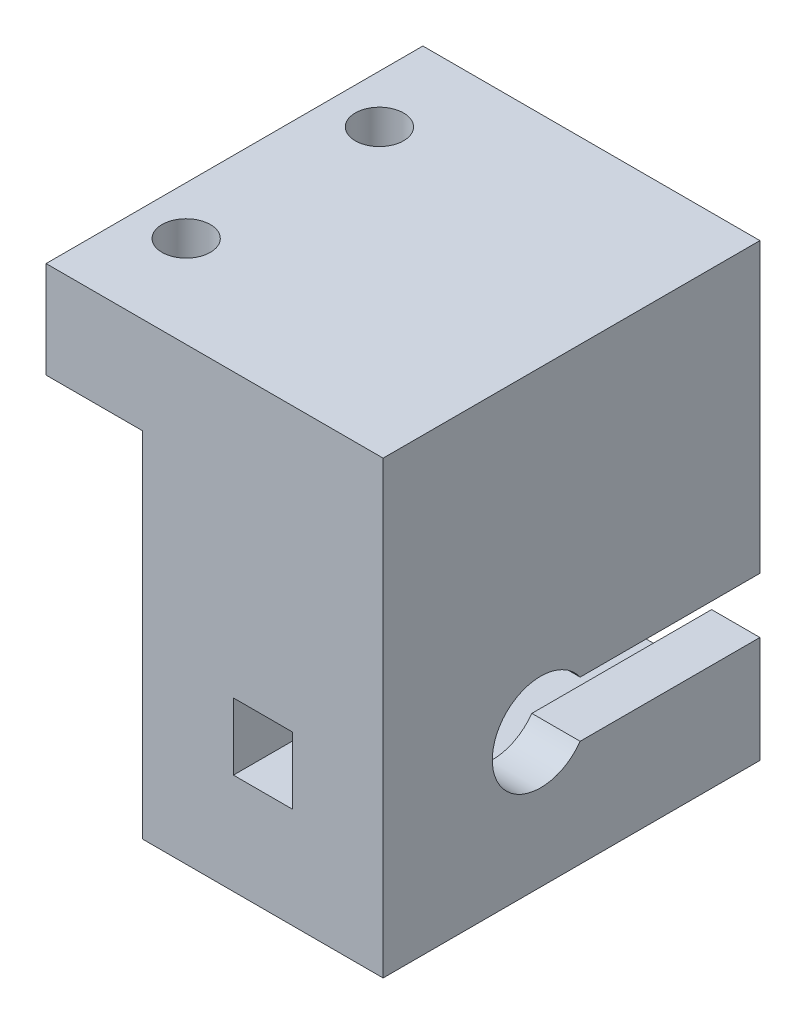
from build123d import *

# Parameters (mm, degrees)
SKETCH1_W           = 31.6
SKETCH1_H           = 35.300000012
SKETCH1_W_2         = 18.9
SKETCH1_H_2         = 22.600000012
BOSS_EXTRUDE1_DEPTH = 40
SKETCH2_W           = 31.6
SKETCH2_H           = 35.300000012
SKETCH2_W_2         = 18.9
SKETCH2_H_2         = 22.600000012
BOSS_EXTRUDE2_DEPTH = 9.525
SKETCH3_W           = 7.74908697
SKETCH3_H           = 8.788598638
CUT_EXTRUDE1_DEPTH  = 12.7
CUT_EXTRUDE2_DEPTH  = 31.75
SKETCH6_W           = 31.6
SKETCH6_H           = 49.525
BOSS_EXTRUDE3_DEPTH = 11.176
BOSS_EXTRUDE4_START = -44.45
SKETCH7_W           = 49.525
SKETCH7_H           = 6.35
BOSS_EXTRUDE4_DEPTH = 57.15
SKETCH8_R           = 3.175
CUT_EXTRUDE3_DEPTH  = 6.35
SKETCH9_W           = 12.85
SKETCH9_H           = 49.525
CUT_EXTRUDE4_DEPTH  = 6.35
SKETCH11_R          = 3.429
SKETCH11_W          = 12.85
SKETCH11_H          = 49.525
CUT_EXTRUDE5_DEPTH  = 6.35
SKETCH12_R          = 6.35
CUT_EXTRUDE6_DEPTH  = 6.35
SKETCH13_W          = 44.3
SKETCH13_H          = 49.525
SKETCH13_R          = 3.175
BOSS_EXTRUDE5_DEPTH = 12.7
SKETCH14_W          = 12.7
SKETCH14_H          = 49.525
SKETCH14_R          = 3.175
CUT_EXTRUDE7_DEPTH  = 6.35


with BuildPart() as part:
    # Sketch1 → Boss-Extrude1 (new body)
    with BuildSketch(Plane.XY):
        Rectangle(SKETCH1_W, SKETCH1_H)
        Rectangle(SKETCH1_W_2, SKETCH1_H_2, mode=Mode.SUBTRACT)
    extrude(amount=BOSS_EXTRUDE1_DEPTH)

    # Sketch2 → Boss-Extrude2 (add)
    # profile 1 of 2: a face of its own
    with BuildSketch(Plane.XY.offset(40)):
        Rectangle(SKETCH2_W, SKETCH2_H)
        Rectangle(SKETCH2_W_2, SKETCH2_H_2, mode=Mode.SUBTRACT)
    # profile 2 of 2: a face of its own
    with BuildSketch(Plane.XY.offset(40)):
        Rectangle(SKETCH2_W_2, SKETCH2_H_2)
    extrude(amount=BOSS_EXTRUDE2_DEPTH)

    # Sketch3 → Cut-Extrude1 (cut)
    with BuildSketch(Plane(origin=(0, 0, 40), x_dir=(-1, 0, 0), z_dir=(0, 0, -1))):
        Rectangle(SKETCH3_W, SKETCH3_H)
    extrude(amount=-CUT_EXTRUDE1_DEPTH, mode=Mode.SUBTRACT)

    # Sketch5 → Cut-Extrude2 (cut)
    with BuildSketch(Plane(origin=(15.8, 0, 0), x_dir=(0, 0, -1), z_dir=(1, 0, 0))):
        with BuildLine():
            Line((-28.827575985, 3.65), (0, 3.65))
            Line((0, 3.65), (0, -3.65))
            Line((0, -3.65), (-28.827575985, -3.65))
            ThreePointArc((-28.827575985, -3.65), (-32.477575985, 0), (-28.827575985, 3.65))
        make_face()
    extrude(amount=-CUT_EXTRUDE2_DEPTH, mode=Mode.SUBTRACT)

    # Sketch6 → Boss-Extrude3 (add)
    with BuildSketch(Plane(origin=(0, 17.650000006, 0), x_dir=(1, 0, 0), z_dir=(0, 1, 0))):
        with Locations((0, -24.7625)):
            Rectangle(SKETCH6_W, SKETCH6_H)
    extrude(amount=BOSS_EXTRUDE3_DEPTH)

    # Sketch7 → Boss-Extrude4 (add)
    with BuildSketch(Plane(origin=(15.8, 0, 0), x_dir=(0, 0, -1), z_dir=(1, 0, 0)).offset(BOSS_EXTRUDE4_START)):
        with Locations((-24.7625, 25.651000006)):
            Rectangle(SKETCH7_W, SKETCH7_H)
    boss_extrude4 = extrude(amount=BOSS_EXTRUDE4_DEPTH)

    # Sketch8 → Cut-Extrude3 (cut)
    with BuildSketch(Plane.XZ.offset(-22.476000006)):
        with Locations(Location((-22.225, 24.7625, 0), (0, 0, 270))):
            Circle(SKETCH8_R)
        with Locations(Location((22.15, 37.434572452, 0), (0, 0, 270))):
            Circle(SKETCH8_R)
        with Locations(Location((22.15, 12.034572452, 0), (0, 0, 270))):
            Circle(SKETCH8_R)
    extrude(amount=-CUT_EXTRUDE3_DEPTH, mode=Mode.SUBTRACT)

    # Sketch9 → Cut-Extrude4 (cut)
    with BuildSketch(Plane.XZ.offset(-22.476000006)):
        with Locations((-22.225, 24.7625)):
            Rectangle(SKETCH9_W, SKETCH9_H)
    extrude(amount=-CUT_EXTRUDE4_DEPTH, mode=Mode.SUBTRACT)

    # Mirror1: Boss-Extrude4 across plane
    add(boss_extrude4.mirror(Plane(origin=(0, 0, 0), x_dir=(0, 0, 1), z_dir=(1, 0, 0))))

    # Sketch11 → Cut-Extrude5 (cut)
    with BuildSketch(Plane(origin=(0, 28.826000006, 0), x_dir=(1, 0, 0), z_dir=(0, 1, 0))):
        with Locations(Location((-22.15, -37.4625, 0), (0, 0, 270))):
            Circle(SKETCH11_R)
        with Locations(Location((-22.15, -12.0625, 0), (0, 0, 270))):
            Circle(SKETCH11_R)
        with Locations((22.225, -24.7625)):
            Rectangle(SKETCH11_W, SKETCH11_H)
    extrude(amount=-CUT_EXTRUDE5_DEPTH, mode=Mode.SUBTRACT)

    # Sketch12 → Cut-Extrude6 (cut)
    with BuildSketch(Plane(origin=(15.8, 0, 0), x_dir=(0, 0, -1), z_dir=(1, 0, 0))):
        with Locations((-28.827575985, 0)):
            Circle(SKETCH12_R)
    extrude(amount=-CUT_EXTRUDE6_DEPTH, mode=Mode.SUBTRACT)

    # Sketch13 → Boss-Extrude5 (add)
    with BuildSketch(Plane(origin=(0, 28.826000006, 0), x_dir=(1, 0, 0), z_dir=(0, 1, 0))):
        with Locations((-6.35, -24.7625)):
            Rectangle(SKETCH13_W, SKETCH13_H)
        with Locations(Location((-22.15, -12.0625, 0), (0, 0, 270))):
            Circle(SKETCH13_R, mode=Mode.SUBTRACT)
        with Locations(Location((-22.15, -37.4625, 0), (0, 0, 270))):
            Circle(SKETCH13_R, mode=Mode.SUBTRACT)
    extrude(amount=BOSS_EXTRUDE5_DEPTH)

    # Sketch14 → Cut-Extrude7 (cut)
    with BuildSketch(Plane.XZ.offset(-22.476000006)):
        with Locations((-22.15, 24.7625)):
            Rectangle(SKETCH14_W, SKETCH14_H)
        with Locations(Location((-22.15, 37.4625, 0), (0, 0, 90))):
            Circle(SKETCH14_R, mode=Mode.SUBTRACT)
        with Locations(Location((-22.15, 12.0625, 0), (0, 0, 90))):
            Circle(SKETCH14_R, mode=Mode.SUBTRACT)
    extrude(amount=-CUT_EXTRUDE7_DEPTH, mode=Mode.SUBTRACT)


solid = part.part
